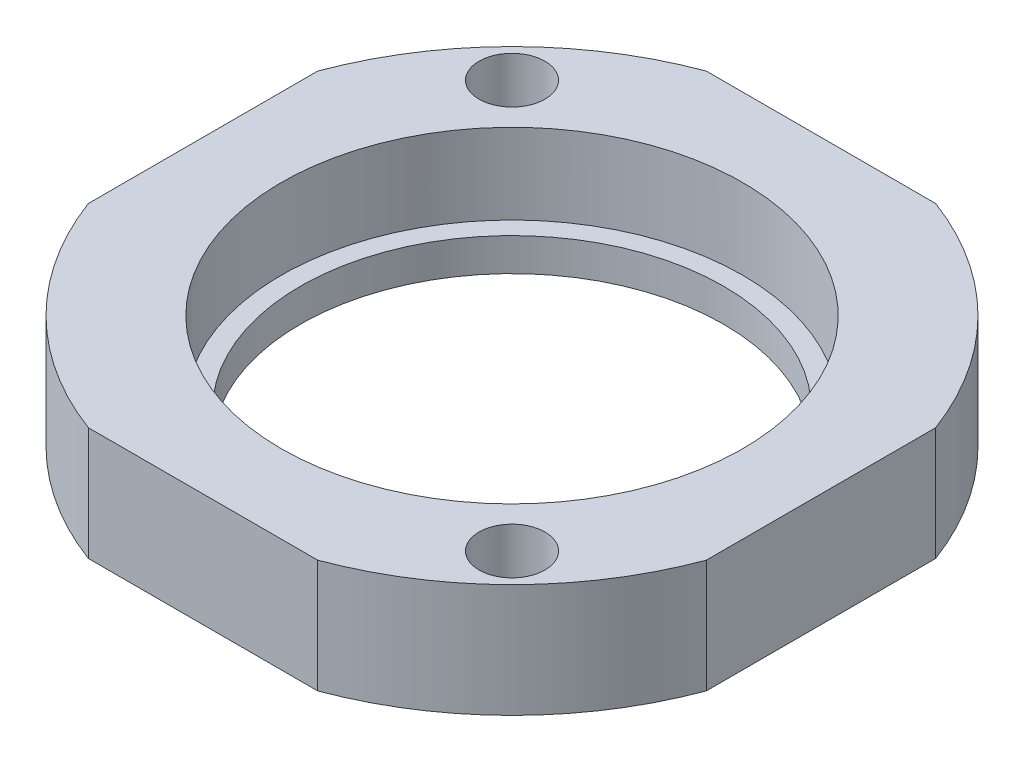
from build123d import *

# Parameters (mm, degrees)
BOSS_EXTRUDE1_DEPTH = 5.5
SKETCH2_R           = 11.2
CUT_EXTRUDE1_DEPTH  = 22.914607001
SKETCH3_R           = 1.6
CUT_EXTRUDE2_DEPTH  = 22.914607001
BOSS_EXTRUDE2_START = -1.6
SKETCH4_R           = 11.2
SKETCH4_R_2         = 10.275
BOSS_EXTRUDE2_DEPTH = 1.6


with BuildPart() as part:
    # Sketch1 → Boss-Extrude1 (new body)
    with BuildSketch(Plane(origin=(0, 0, 0), x_dir=(1, 0, 0), z_dir=(0, 1, 0))):
        with BuildLine():
            ThreePointArc((15, 5.567764363), (11.313708499, 11.313708499), (5.567764363, 15))
            Line((5.567764363, 15), (-5.567764363, 15))
            ThreePointArc((-5.567764363, 15), (-11.313708499, 11.313708499), (-15, 5.567764363))
            Line((-15, 5.567764363), (-15, -5.567764363))
            ThreePointArc((-15, -5.567764363), (-11.313708499, -11.313708499), (-5.567764363, -15))
            Line((-5.567764363, -15), (5.567764363, -15))
            ThreePointArc((5.567764363, -15), (11.313708499, -11.313708499), (15, -5.567764363))
            Line((15, -5.567764363), (15, 5.567764363))
        make_face()
    extrude(amount=-BOSS_EXTRUDE1_DEPTH)

    # Sketch2 → Cut-Extrude1 (cut, through all)
    with BuildSketch(Plane(origin=(0, 0, 0), x_dir=(1, 0, 0), z_dir=(0, 1, 0))):
        with Locations(Location((0, 0, 0), (0, 0, 270))):
            Circle(SKETCH2_R)
    extrude(amount=-CUT_EXTRUDE1_DEPTH, mode=Mode.SUBTRACT)

    # Sketch3 → Cut-Extrude2 (cut, through all)
    with BuildSketch(Plane(origin=(0, 0, 0), x_dir=(1, 0, 0), z_dir=(0, 1, 0))):
        with Locations(Location((-9.899494937, 9.899494937, 0), (0, 0, 270))):
            Circle(SKETCH3_R)
        with Locations(Location((9.899494937, -9.899494937, 0), (0, 0, 270))):
            Circle(SKETCH3_R)
    extrude(amount=-CUT_EXTRUDE2_DEPTH, mode=Mode.SUBTRACT)

    # Sketch4 → Boss-Extrude2 (add)
    with BuildSketch(Plane.XZ.offset(5.5).offset(BOSS_EXTRUDE2_START)):
        with Locations(Location((0, 0, 0), (0, 0, 90))):
            Circle(SKETCH4_R)
        with Locations(Location((0, 0, 0), (0, 0, 270))):
            Circle(SKETCH4_R_2, mode=Mode.SUBTRACT)
    extrude(amount=BOSS_EXTRUDE2_DEPTH)


solid = part.part
